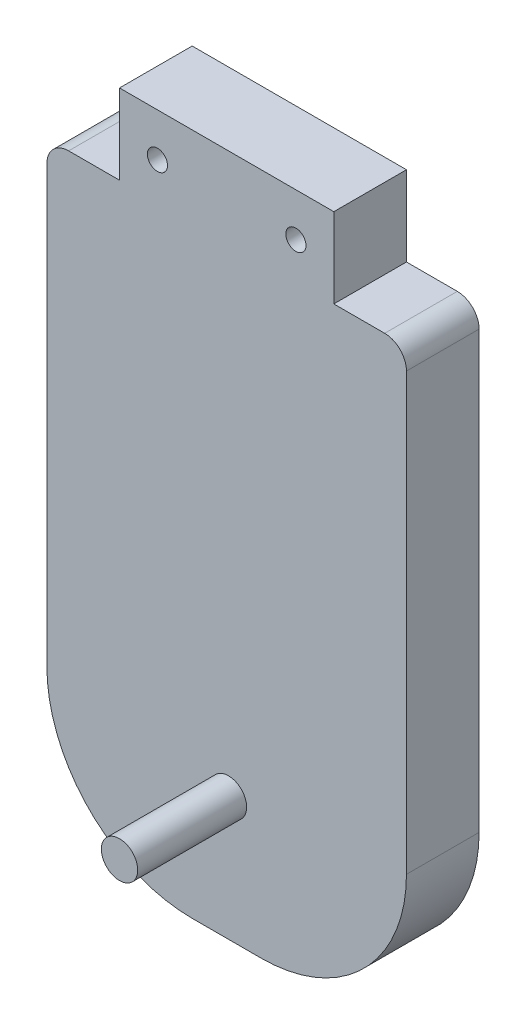
from build123d import *

# Parameters (mm, degrees)
IZIM1_R                     = 1.388888889
Y_KSEKLIK_EKSTR_ZYON1_DEPTH = 10
IZIM2_R                     = 2.5
Y_KSEKLIK_EKSTR_ZYON2_DEPTH = 15


with BuildPart() as part:
    # Çizim1 → Yükseklik-Ekstrüzyon1 (new body)
    with BuildSketch(Plane.XY.offset(10)):
        with BuildLine():
            Line((11.575672227, 67.181181276), (4.575672227, 67.181181276))
            ThreePointArc((4.575672227, 67.181181276), (2.454351883, 66.30250162), (1.575672227, 64.181181276))
            Line((1.575672227, 64.181181276), (1.575672227, 4.181181276))
            ThreePointArc((1.575672227, 4.181181276), (7.433536603, -9.960954347), (21.575672227, -15.818818724))
            Line((21.575672227, -15.818818724), (31.075672227, -15.818818724))
            ThreePointArc((31.075672227, -15.818818724), (45.21780785, -9.960954347), (51.075672227, 4.181181276))
            Line((51.075672227, 4.181181276), (51.075672227, 64.181181276))
            ThreePointArc((51.075672227, 64.181181276), (50.19699257, 66.30250162), (48.075672227, 67.181181276))
            Line((48.075672227, 67.181181276), (41.075672227, 67.181181276))
            Line((41.075672227, 67.181181276), (41.075672227, 78.181181276))
            Line((41.075672227, 78.181181276), (11.575672227, 78.181181276))
            Line((11.575672227, 78.181181276), (11.575672227, 67.181181276))
        make_face()
        with Locations(Location((16.795672227, 72.222222222, 0), (0, 0, 180))):
            Circle(IZIM1_R, mode=Mode.SUBTRACT)
        with Locations(Location((35.853450004, 72.222222222, 0), (0, 0, 180))):
            Circle(IZIM1_R, mode=Mode.SUBTRACT)
    extrude(amount=-Y_KSEKLIK_EKSTR_ZYON1_DEPTH)

    # Çizim2 → Yükseklik-Ekstrüzyon2 (add)
    with BuildSketch(Plane.XY.offset(10)):
        with Locations((26.575672227, 1.181181276)):
            Circle(IZIM2_R)
    extrude(amount=Y_KSEKLIK_EKSTR_ZYON2_DEPTH)


solid = part.part
